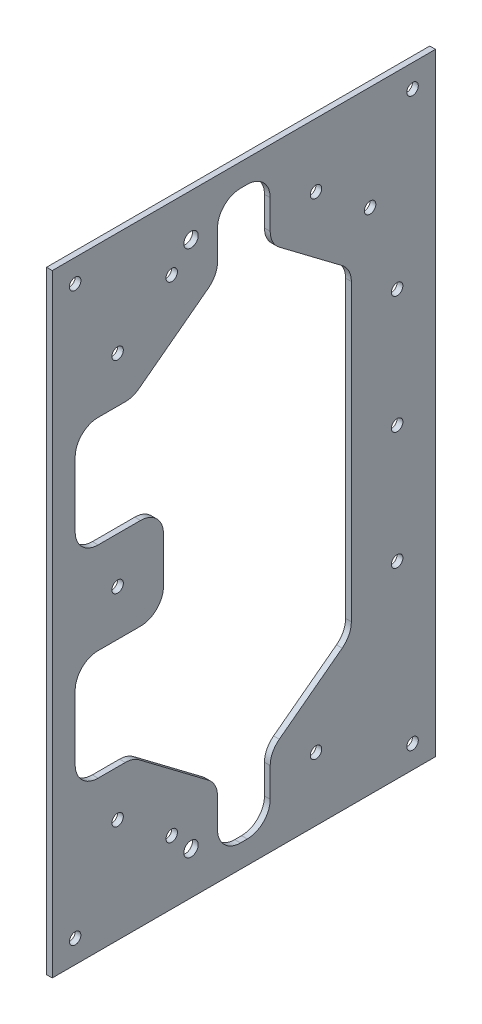
from build123d import *

# Parameters (mm, degrees)
SKETCH1_W           = 212.5
SKETCH1_H           = 339.725
SKETCH1_R           = 3.175
BOSS_EXTRUDE1_DEPTH = 3.175
CUT_EXTRUDE1_DEPTH  = 401.72360331
SKETCH3_R           = 4
CUT_EXTRUDE2_DEPTH  = 45.72
SKETCH4_R           = 4
CUT_EXTRUDE3_DEPTH  = 14.986


with BuildPart() as part:
    # Sketch1 → Boss-Extrude1 (new body)
    with BuildSketch(Plane(origin=(0, 0, 0), x_dir=(0, 0, -1), z_dir=(1, 0, 0))):
        with Locations((106.25, -169.8625)):
            Rectangle(SKETCH1_W, SKETCH1_H)
        with Locations((12.7, -12.7)):
            Circle(SKETCH1_R, mode=Mode.SUBTRACT)
        with Locations((199.8, -12.7)):
            Circle(SKETCH1_R, mode=Mode.SUBTRACT)
        with Locations((66.25, -35.2425)):
            Circle(SKETCH1_R, mode=Mode.SUBTRACT)
        with Locations((146.25, -35.2425)):
            Circle(SKETCH1_R, mode=Mode.SUBTRACT)
        with Locations((176.25, -57.8625)):
            Circle(SKETCH1_R, mode=Mode.SUBTRACT)
        with Locations((36.25, -57.8625)):
            Circle(SKETCH1_R, mode=Mode.SUBTRACT)
        with Locations((191.25, -104.5325)):
            Circle(SKETCH1_R, mode=Mode.SUBTRACT)
        with Locations((36.25, -169.8625)):
            Circle(SKETCH1_R, mode=Mode.SUBTRACT)
        with Locations((191.25, -169.8625)):
            Circle(SKETCH1_R, mode=Mode.SUBTRACT)
        with Locations((36.25, -281.8625)):
            Circle(SKETCH1_R, mode=Mode.SUBTRACT)
        with Locations((66.25, -304.4825)):
            Circle(SKETCH1_R, mode=Mode.SUBTRACT)
        with Locations((12.7, -327.025)):
            Circle(SKETCH1_R, mode=Mode.SUBTRACT)
        with Locations((199.8, -327.025)):
            Circle(SKETCH1_R, mode=Mode.SUBTRACT)
        with Locations((146.25, -304.4825)):
            Circle(SKETCH1_R, mode=Mode.SUBTRACT)
        with Locations(Location((191.25, -235.1925, 0), (0, 0, 180))):
            Circle(SKETCH1_R, mode=Mode.SUBTRACT)
    extrude(amount=BOSS_EXTRUDE1_DEPTH)

    # Sketch2 → Cut-Extrude1 (cut, through all)
    with BuildSketch(Plane(origin=(3.175, 0, 0), x_dir=(0, 0, -1), z_dir=(1, 0, 0))):
        with BuildLine():
            Line((165.85, -88.161695758), (165.85, -251.563304242))
            ThreePointArc((165.85, -251.563304242), (164.516472011, -257.22840036), (160.795934799, -261.703801323))
            Line((160.795934799, -261.703801323), (125.904065201, -288.012271))
            ThreePointArc((125.904065201, -288.012271), (122.183527989, -292.487671963), (120.85, -298.152768081))
            Line((120.85, -298.152768081), (120.85, -314.325))
            ThreePointArc((120.85, -314.325), (117.130256121, -323.305256121), (108.15, -327.025))
            Line((108.15, -327.025), (104.35, -327.025))
            ThreePointArc((104.35, -327.025), (95.369743879, -323.305256121), (91.65, -314.325))
            Line((91.65, -314.325), (91.65, -298.152768081))
            ThreePointArc((91.65, -298.152768081), (90.316472011, -292.487671963), (86.595934799, -288.012271))
            Line((86.595934799, -288.012271), (48.147303392, -259.022002919))
            ThreePointArc((48.147303392, -259.022002919), (44.532850149, -257.119362682), (40.501368593, -256.4625))
            Line((40.501368593, -256.4625), (25.4, -256.4625))
            ThreePointArc((25.4, -256.4625), (16.419743879, -252.742756121), (12.7, -243.7625))
            Line((12.7, -243.7625), (12.7, -207.9625))
            ThreePointArc((12.7, -207.9625), (16.419743879, -198.982243879), (25.4, -195.2625))
            Line((25.4, -195.2625), (48.95, -195.2625))
            ThreePointArc((48.95, -195.2625), (57.930256121, -191.542756121), (61.65, -182.5625))
            Line((61.65, -182.5625), (61.65, -157.1625))
            ThreePointArc((61.65, -157.1625), (57.930256121, -148.182243879), (48.95, -144.4625))
            Line((48.95, -144.4625), (25.4, -144.4625))
            ThreePointArc((25.4, -144.4625), (16.419743879, -140.742756121), (12.7, -131.7625))
            Line((12.7, -131.7625), (12.7, -95.9625))
            ThreePointArc((12.7, -95.9625), (16.419743879, -86.982243879), (25.4, -83.2625))
            Line((25.4, -83.2625), (40.501368593, -83.2625))
            ThreePointArc((40.501368593, -83.2625), (44.532850149, -82.605637318), (48.147303392, -80.702997081))
            Line((48.147303392, -80.702997081), (86.595934799, -51.712729))
            ThreePointArc((86.595934799, -51.712729), (90.316472011, -47.237328037), (91.65, -41.572231919))
            Line((91.65, -41.572231919), (91.65, -25.4))
            ThreePointArc((91.65, -25.4), (95.369743879, -16.419743879), (104.35, -12.7))
            Line((104.35, -12.7), (108.15, -12.7))
            ThreePointArc((108.15, -12.7), (117.130256121, -16.419743879), (120.85, -25.4))
            Line((120.85, -25.4), (120.85, -41.572231919))
            ThreePointArc((120.85, -41.572231919), (122.183527989, -47.237328037), (125.904065201, -51.712729))
            Line((125.904065201, -51.712729), (160.795934799, -78.021198677))
            ThreePointArc((160.795934799, -78.021198677), (164.516472011, -82.49659964), (165.85, -88.161695758))
        make_face()
    extrude(amount=-CUT_EXTRUDE1_DEPTH, mode=Mode.SUBTRACT)

    # Sketch3 → Cut-Extrude2 (cut)
    with BuildSketch(Plane.ZY):
        with Locations((-76.95, -316.111459893)):
            Circle(SKETCH3_R)
    extrude(amount=-CUT_EXTRUDE2_DEPTH, mode=Mode.SUBTRACT)

    # Sketch4 → Cut-Extrude3 (cut)
    with BuildSketch(Plane.ZY):
        with Locations((-76.9625, -23.613540107)):
            Circle(SKETCH4_R)
    extrude(amount=-CUT_EXTRUDE3_DEPTH, mode=Mode.SUBTRACT)


solid = part.part
